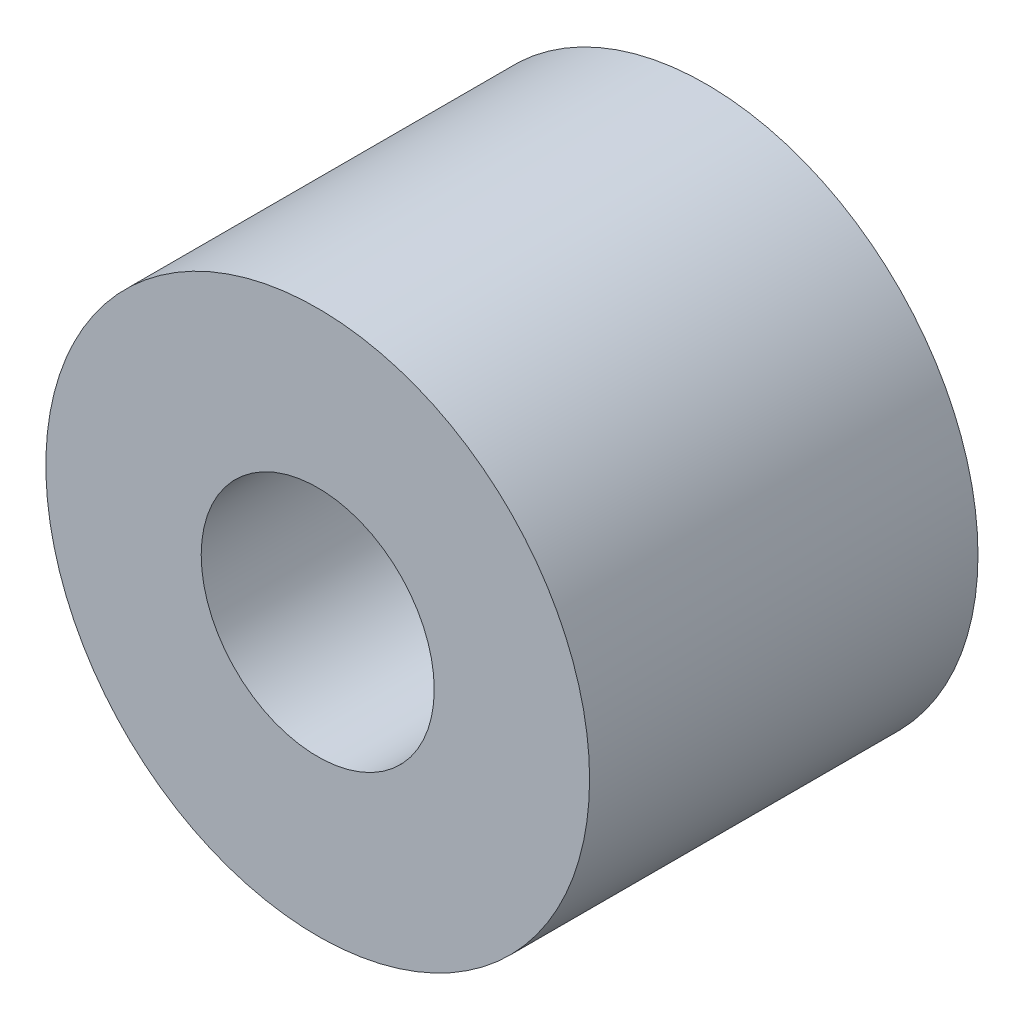
from build123d import *

# Parameters (mm, degrees)
SKETCH_2_R      = 3.5
SKETCH_2_R_2    = 1.5
EXTRUDE_1_DEPTH = 5


with BuildPart() as part:
    # 草图2 → 凸台-拉伸1 (new body)
    with BuildSketch(Plane.XY):
        Circle(SKETCH_2_R)
        Circle(SKETCH_2_R_2, mode=Mode.SUBTRACT)
    extrude(amount=EXTRUDE_1_DEPTH)


solid = part.part
